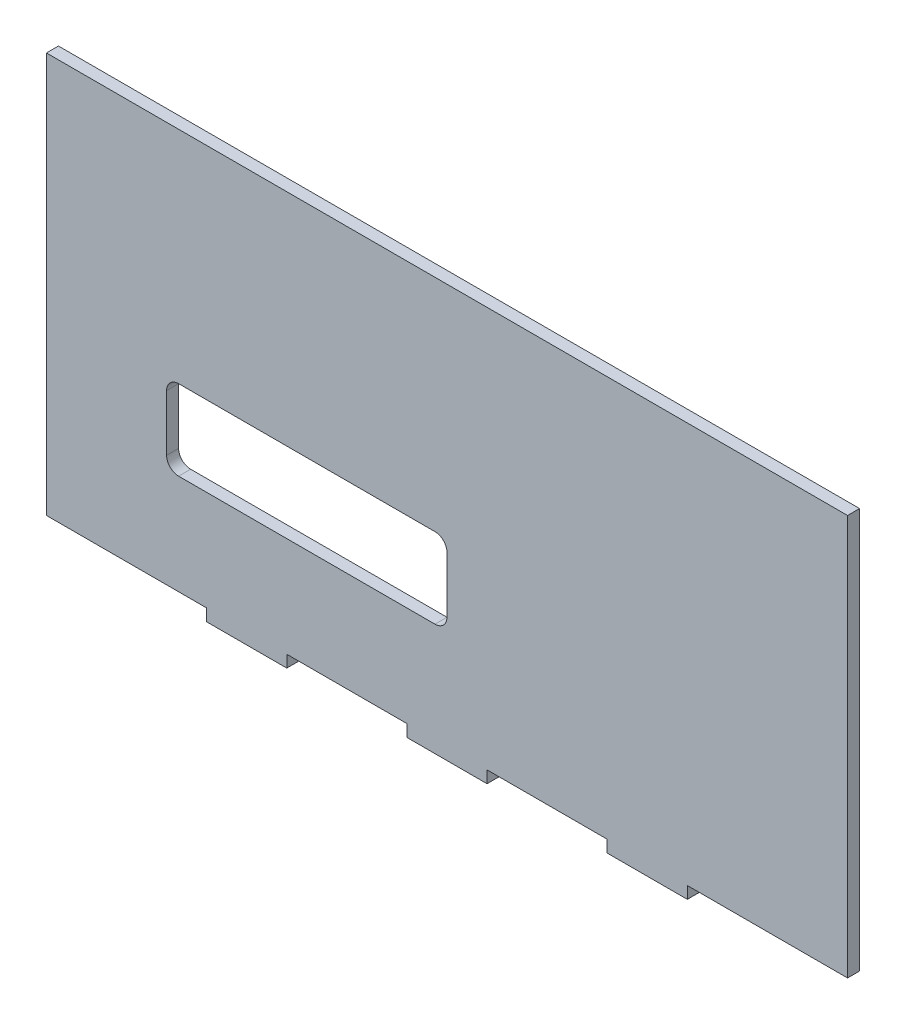
from build123d import *

# Parameters (mm, degrees)
BOSS_EXTRUDE1_DEPTH = 3


with BuildPart() as part:
    # Sketch1 → Boss-Extrude1 (new body)
    with BuildSketch(Plane.XY):
        Polygon((-100, -50), (-60, -50), (-60, -53), (-40, -53), (-40, -50), (-10, -50), (-10, -53), (10, -53), (10, -50), (40, -50), (40, -53), (60, -53), (60, -50), (100, -50), (100, 50), (-100, 50), align=None)
        with BuildLine():
            Line((-67, -25), (-3, -25))
            ThreePointArc((-3, -25), (-0.878679656, -24.121320344), (0, -22))
            Line((0, -22), (0, -8))
            ThreePointArc((0, -8), (-0.878679656, -5.878679656), (-3, -5))
            Line((-3, -5), (-67, -5))
            ThreePointArc((-67, -5), (-69.121320344, -5.878679656), (-70, -8))
            Line((-70, -8), (-70, -22))
            ThreePointArc((-70, -22), (-69.121320344, -24.121320344), (-67, -25))
        make_face(mode=Mode.SUBTRACT)
    extrude(amount=BOSS_EXTRUDE1_DEPTH)


solid = part.part
